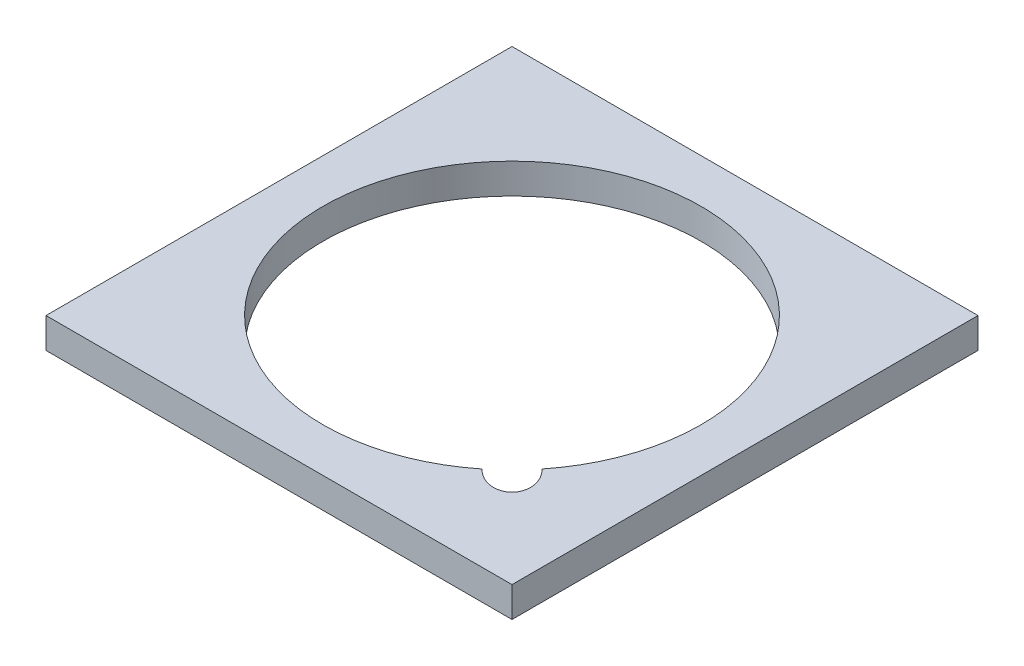
from build123d import *

# Parameters (mm, degrees)
SKETCH1_W           = 154
SKETCH1_H           = 154
BOSS_EXTRUDE1_DEPTH = 10


with BuildPart() as part:
    # Sketch1 → Boss-Extrude1 (new body)
    with BuildSketch(Plane(origin=(0, 0, 0), x_dir=(1, 0, 0), z_dir=(0, 1, 0))):
        with Locations((77, 77)):
            Rectangle(SKETCH1_W, SKETCH1_H)
        with BuildLine():
            ThreePointArc((125.861682212, 38.028394806), (32.805826176, 121.194173824), (115.971605194, 28.138317788))
            add(Edge.make_bspline(
                [(115.971605194, 28.138317788), (122.387611631, 21.271341921), (127.558134855, 26.441865145), (132.728658079, 31.612388369), (125.861682212, 38.028394806)],
                knots=[1.527172841, 1.527172841, 1.527172841, 3.141592654, 3.141592654, 4.756012466, 4.756012466, 4.756012466], degree=2, weights=[1, 0.691516576, 1, 0.691516576, 1]))
        make_face(mode=Mode.SUBTRACT)
    extrude(amount=BOSS_EXTRUDE1_DEPTH)


solid = part.part
